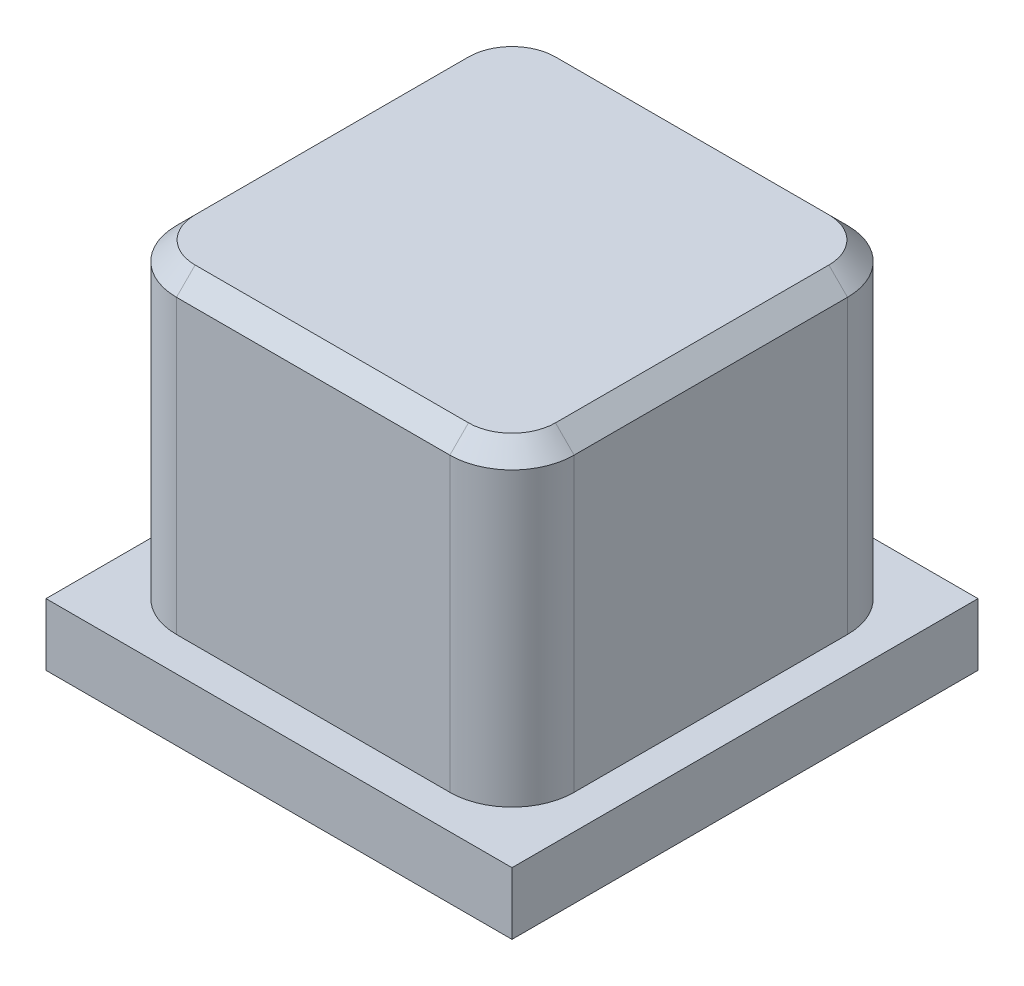
from build123d import *

# Parameters (mm, degrees)
SKETCH_1_W      = 15
SKETCH_1_H      = 15
EXTRUDE_1_DEPTH = 3
SKETCH_2_W      = 12.8
SKETCH_2_H      = 12.8
EXTRUDE_2_DEPTH = 10
CHAMFER_1_SIZE  = 1
FILLET_1_R      = 2
CHAMFER_2_SIZE  = 0.6


with BuildPart() as part:
    # 草图1 → 凸台-拉伸1 (new body)
    with BuildSketch(Plane(origin=(0, 0, 0), x_dir=(1, 0, 0), z_dir=(0, 1, 0))):
        Rectangle(SKETCH_1_W, SKETCH_1_H)
    extrude(amount=EXTRUDE_1_DEPTH)

    # 草图2 → 凸台-拉伸2 (add)
    with BuildSketch(Plane(origin=(0, 3, 0), x_dir=(1, 0, 0), z_dir=(0, 1, 0))):
        Rectangle(SKETCH_2_W, SKETCH_2_H)
    extrude(amount=EXTRUDE_2_DEPTH)

    # 倒角1
    chamfer_1_edges = [part.edges().sort_by_distance(p)[0] for p in [
        (0, 0, 7.5),
        (-7.5, 0, 0),
        (0, 0, -7.5),
        (7.5, 0, 0),
    ]]
    chamfer(chamfer_1_edges, length=CHAMFER_1_SIZE)

    # 圆角1
    fillet_1_edges = [part.edges().sort_by_distance(p)[0] for p in [
        (6.4, 8, 6.4),
        (6.4, 8, -6.4),
        (-6.4, 8, -6.4),
        (-6.4, 8, 6.4),
    ]]
    fillet(fillet_1_edges, radius=FILLET_1_R)

    # 倒角2
    chamfer_2_edges = [part.edges().sort_by_distance(p)[0] for p in [
        (0, 13, -6.4),
        (6.4, 13, 0),
        (-6.4, 13, 0),
        (0, 13, 6.4),
        (5.814213562, 13, 5.814213562),
        (-5.814213562, 13, 5.814213562),
        (-5.814213562, 13, -5.814213562),
        (5.814213562, 13, -5.814213562),
    ]]
    chamfer(chamfer_2_edges, length=CHAMFER_2_SIZE)


solid = part.part
